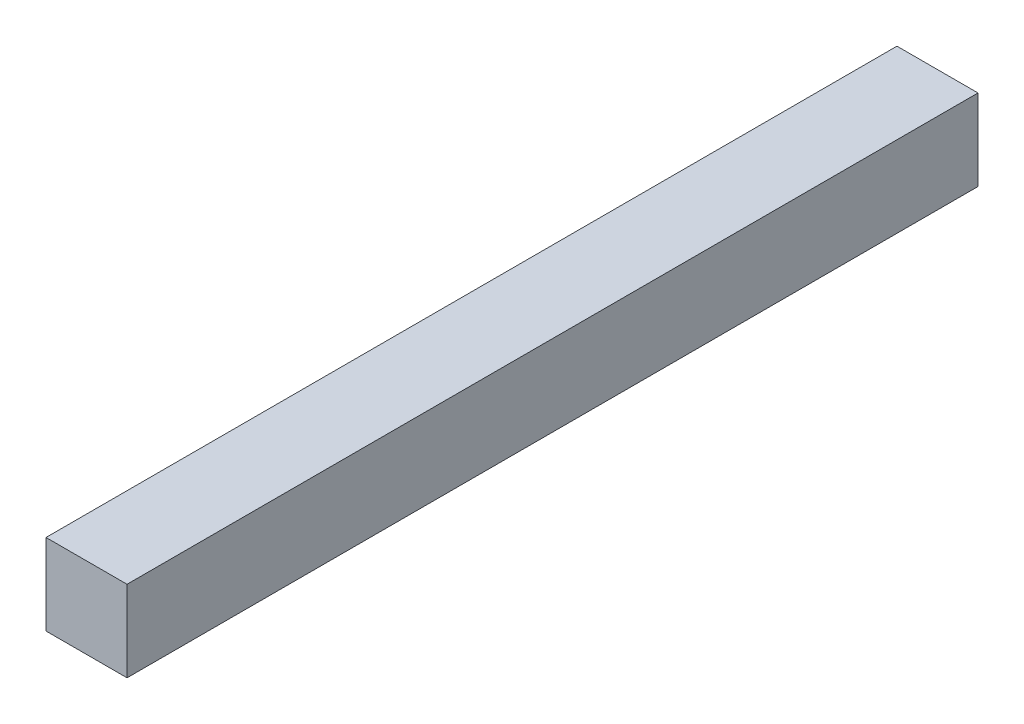
from build123d import *

# Parameters (mm, degrees)
SKETCH1_W           = 40
SKETCH1_H           = 40
BOSS_EXTRUDE1_DEPTH = 420


with BuildPart() as part:
    # Sketch1 → Boss-Extrude1 (new body)
    with BuildSketch(Plane.XY):
        with Locations((-255.025380711, 73.807106599)):
            Rectangle(SKETCH1_W, SKETCH1_H)
    extrude(amount=BOSS_EXTRUDE1_DEPTH)


solid = part.part
